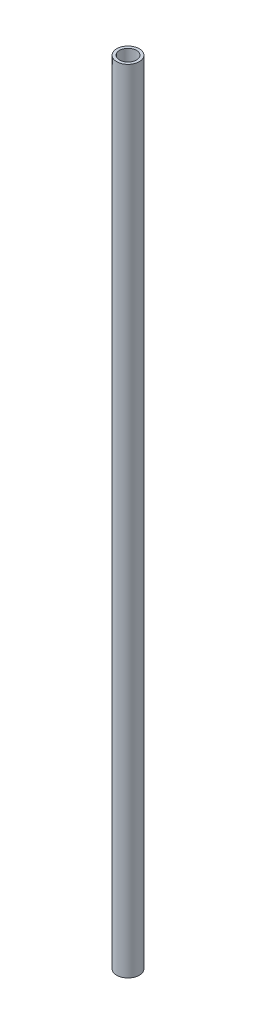
from build123d import *

# Parameters (mm, degrees)
SKETCH1_R           = 6.35
SKETCH1_R_2         = 4.7625
BOSS_EXTRUDE1_DEPTH = 446.2018


with BuildPart() as part:
    # Sketch1 → Boss-Extrude1 (new body)
    with BuildSketch(Plane(origin=(0, 0, 0), x_dir=(1, 0, 0), z_dir=(0, 1, 0))):
        with Locations(Location((0, 0, 0), (0, 0, 270))):
            Circle(SKETCH1_R)
        with Locations(Location((0, 0, 0), (0, 0, 270))):
            Circle(SKETCH1_R_2, mode=Mode.SUBTRACT)
    extrude(amount=BOSS_EXTRUDE1_DEPTH)


solid = part.part
